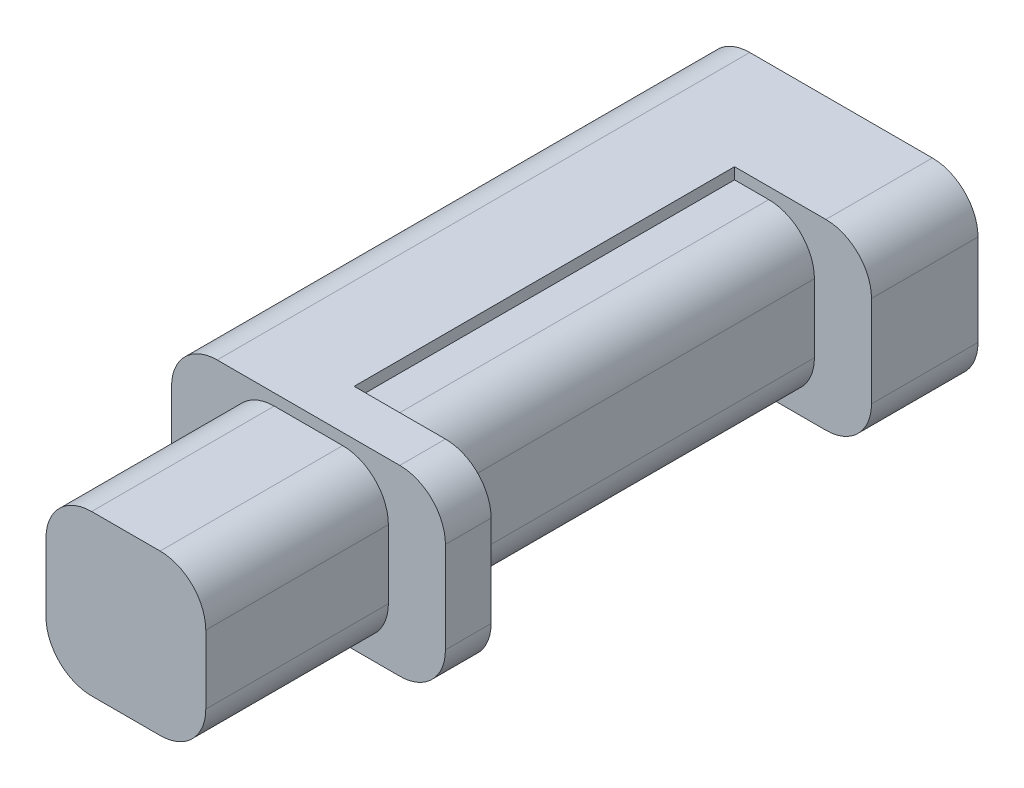
from build123d import *

# Parameters (mm, degrees)
BOSS_EXTRUDE1_DEPTH = 40
BOSS_EXTRUDE2_DEPTH = 7
BOSS_EXTRUDE3_START = 25
BOSS_EXTRUDE3_DEPTH = 25
BOSS_EXTRUDE4_START = -12
BOSS_EXTRUDE4_DEPTH = 3


with BuildPart() as part:
    # Sketch1 → Boss-Extrude1 (new body)
    with BuildSketch(Plane.XY):
        with BuildLine():
            Line((-2.25, 5.25), (2.25, 5.25))
            ThreePointArc((2.25, 5.25), (4.371320344, 4.371320344), (5.25, 2.25))
            Line((5.25, 2.25), (5.25, -2.25))
            ThreePointArc((5.25, -2.25), (4.371320344, -4.371320344), (2.25, -5.25))
            Line((2.25, -5.25), (-2.25, -5.25))
            ThreePointArc((-2.25, -5.25), (-4.371320344, -4.371320344), (-5.25, -2.25))
            Line((-5.25, -2.25), (-5.25, 2.25))
            ThreePointArc((-5.25, 2.25), (-4.371320344, 4.371320344), (-2.25, 5.25))
        make_face()
    extrude(amount=BOSS_EXTRUDE1_DEPTH)

    # Sketch2 → Boss-Extrude2 (add)
    with BuildSketch(Plane.XY):
        with BuildLine():
            Line((8.999999945, -3.000810302), (8.999999945, 2.999189698))
            ThreePointArc((8.999999945, 2.999189698), (8.121463527, 5.120366794), (6.000405096, 5.999189671))
            Line((6.000405096, 5.999189671), (-5.999594794, 6.000810275))
            ThreePointArc((-5.999594794, 6.000810275), (-8.121177041, 5.122273883), (-8.999999945, 3.000810302))
            Line((-8.999999945, 3.000810302), (-8.999999945, -2.999189698))
            ThreePointArc((-8.999999945, -2.999189698), (-8.121463527, -5.120366794), (-6.000405096, -5.999189671))
            Line((-6.000405096, -5.999189671), (5.999594794, -6.000810275))
            ThreePointArc((5.999594794, -6.000810275), (8.121177041, -5.122273883), (8.999999945, -3.000810302))
        make_face()
    extrude(amount=-BOSS_EXTRUDE2_DEPTH)

    # Sketch3 → Boss-Extrude3 (add)
    with BuildSketch(Plane.XY.offset(BOSS_EXTRUDE3_START)):
        with BuildLine():
            Line((0.000405151, 5.25), (-5.999999945, 5.25))
            ThreePointArc((-5.999999945, 5.25), (-7.590417233, 4.59122759), (-8.249189643, 3.000810302))
            Line((-8.249189643, 3.000810302), (-8.249189643, -2.999189698))
            ThreePointArc((-8.249189643, -2.999189698), (-7.590631979, -4.58939221), (-6.000607381, -5.248379314))
            Line((-6.000607381, -5.248379314), (0.000405151, -5.25))
            Line((0.000405151, -5.25), (0.000405151, -6.000000082))
            Line((0.000405151, -6.000000082), (-6.000405096, -5.999189671))
            ThreePointArc((-6.000405096, -5.999189671), (-8.121463527, -5.120366794), (-8.999999945, -2.999189698))
            Line((-8.999999945, -2.999189698), (-8.999999945, 3.000810302))
            ThreePointArc((-8.999999945, 3.000810302), (-8.121177041, 5.122273883), (-5.999594794, 6.000810275))
            Line((-5.999594794, 6.000810275), (0.000405151, 5.999999973))
            Line((0.000405151, 5.999999973), (0.000405151, 5.25))
        make_face()
    extrude(amount=-BOSS_EXTRUDE3_DEPTH)

    # Sketch5 → Boss-Extrude4 (add)
    with BuildSketch(Plane.XY.offset(40).offset(BOSS_EXTRUDE4_START)):
        with BuildLine():
            Line((0.000405151, -6.000000082), (5.999594794, -6.000810275))
            ThreePointArc((5.999594794, -6.000810275), (8.121177041, -5.122273883), (8.999999945, -3.000810302))
            Line((8.999999945, -3.000810302), (8.999999945, 2.999189698))
            ThreePointArc((8.999999945, 2.999189698), (8.121463527, 5.120366794), (6.000405096, 5.999189671))
            Line((6.000405096, 5.999189671), (0.000405151, 5.999999973))
            Line((0.000405151, 5.999999973), (-5.999594794, 6.000810275))
            ThreePointArc((-5.999594794, 6.000810275), (-8.121177041, 5.122273883), (-8.999999945, 3.000810302))
            Line((-8.999999945, 3.000810302), (-8.999999945, -2.999189698))
            ThreePointArc((-8.999999945, -2.999189698), (-8.121463527, -5.120366794), (-6.000405096, -5.999189671))
            Line((-6.000405096, -5.999189671), (0.000405151, -6.000000082))
        make_face()
    extrude(amount=-BOSS_EXTRUDE4_DEPTH)


solid = part.part
